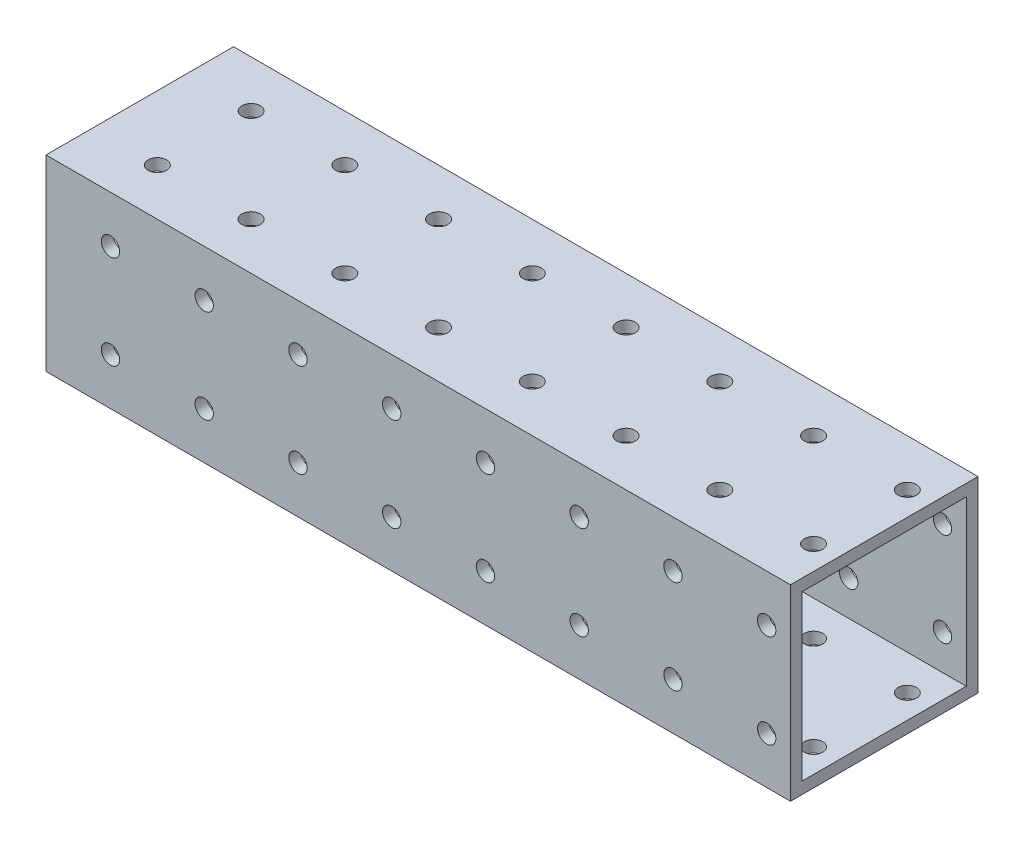
from build123d import *

# Parameters (mm, degrees)
SKETCH1_W           = 50.8
SKETCH1_H           = 50.8
BOSS_EXTRUDE1_DEPTH = 201.72011345
SHELL1_T            = -3.175
SKETCH2_R           = 2.4892
CUT_EXTRUDE3_DEPTH  = 215.13146469
SKETCH3_R           = 2.4892
CUT_EXTRUDE2_DEPTH  = 215.13146469
LPATTERN1_COUNT     = 8
LPATTERN1_PITCH     = 25.4


with BuildPart() as part:
    # Sketch1 → Boss-Extrude1 (new body)
    with BuildSketch(Plane(origin=(0, 0, 0), x_dir=(0, 0, -1), z_dir=(1, 0, 0))):
        with Locations((25.4, 25.4)):
            Rectangle(SKETCH1_W, SKETCH1_H)
    extrude(amount=BOSS_EXTRUDE1_DEPTH)

    # Shell1
    shell1_openings = [part.faces().sort_by_distance(p)[0] for p in [
        (201.72011345, 25.4, -25.4),
        (0, 25.4, -25.4),
    ]]
    offset(amount=SHELL1_T, openings=shell1_openings, kind=Kind.INTERSECTION)

    # Sketch2 → Cut-Extrude3 (cut, through all)
    with BuildSketch(Plane(origin=(0, 0, -50.8), x_dir=(-1, 0, 0), z_dir=(0, 0, -1))):
        with Locations((-195.262511684, 38.1)):
            Circle(SKETCH2_R)
        with Locations((-195.262511684, 12.7)):
            Circle(SKETCH2_R)
    cut_extrude3 = extrude(amount=-CUT_EXTRUDE3_DEPTH, mode=Mode.SUBTRACT)

    # Sketch3 → Cut-Extrude2 (cut, through all)
    with BuildSketch(Plane.XZ):
        with Locations(Location((195.262511684, -12.7, 0), (0, 0, 270))):
            Circle(SKETCH3_R)
        with Locations(Location((195.262511684, -38.1, 0), (0, 0, 270))):
            Circle(SKETCH3_R)
    cut_extrude2 = extrude(amount=-CUT_EXTRUDE2_DEPTH, mode=Mode.SUBTRACT)

    # LPattern1: Cut-Extrude3, Cut-Extrude2 ×8
    with Locations(*[(-i * LPATTERN1_PITCH, 0, 0) for i in range(1, LPATTERN1_COUNT)]):
        add(cut_extrude3, mode=Mode.SUBTRACT)
        add(cut_extrude2, mode=Mode.SUBTRACT)


solid = part.part
